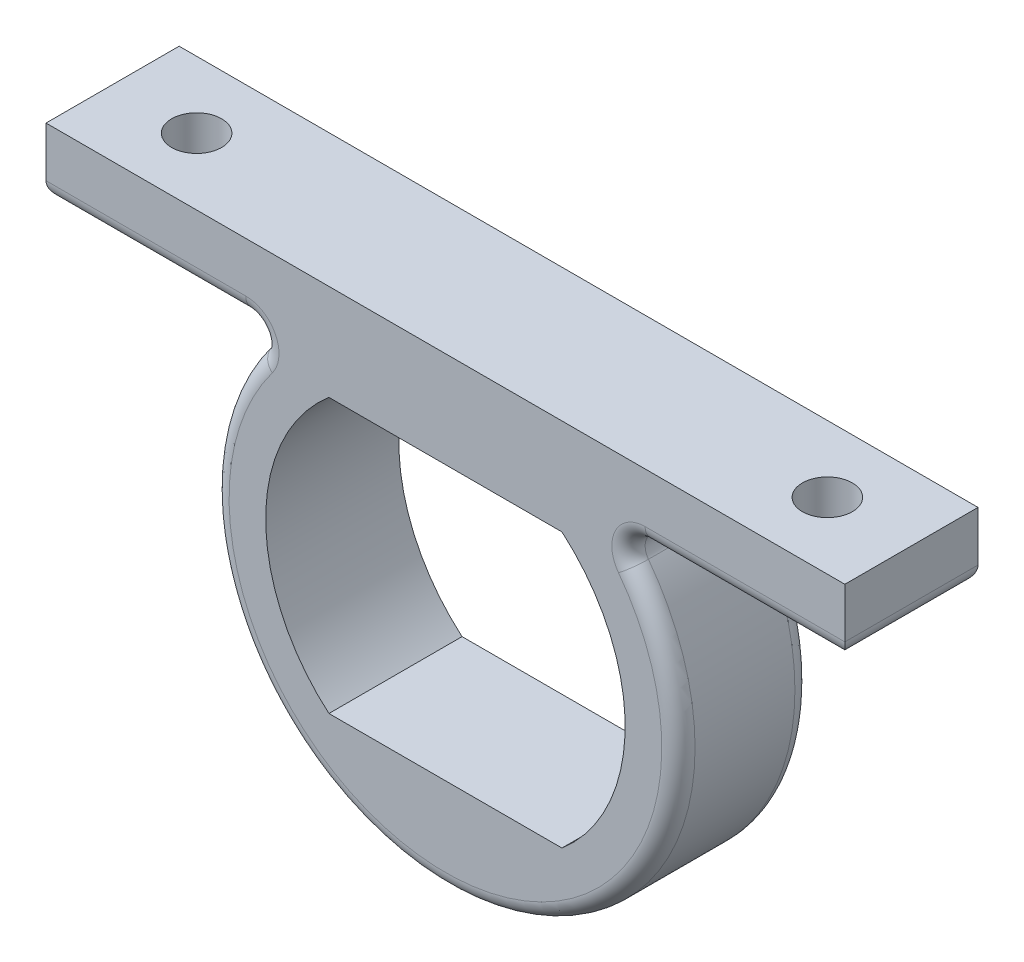
from build123d import *

# Parameters (mm, degrees)
SALIENTE_EXTRUIR1_DEPTH = 8
CORTAR_EXTRUIR1_DEPTH   = 29.91366459
REDONDEO1_R             = 1
CROQUIS3_R              = 1.5
CORTAR_EXTRUIR2_DEPTH   = 35.871191548


with BuildPart() as part:
    # Croquis1 → Saliente-Extruir1 (new body)
    with BuildSketch(Plane.XY):
        with BuildLine():
            Line((0, 14), (-24, 14))
            Line((-24, 14), (-24, 10))
            Line((-24, 10), (-9.797958971, 10))
            ThreePointArc((-9.797958971, 10), (0, -14), (9.797958971, 10))
            Line((9.797958971, 10), (24, 10))
            Line((24, 10), (24, 14))
            Line((24, 14), (0, 14))
        make_face()
    extrude(amount=SALIENTE_EXTRUIR1_DEPTH)

    # Croquis2 → Cortar-Extruir1 (cut, through all)
    with BuildSketch(Plane.XY.offset(8)):
        with BuildLine():
            Line((-7, 8.224354078), (7, 8.224354078))
            ThreePointArc((7, 8.224354078), (10.8, 0), (7, -8.224354078))
            Line((7, -8.224354078), (-7, -8.224354078))
            ThreePointArc((-7, -8.224354078), (-10.8, 0), (-7, 8.224354078))
        make_face()
    extrude(amount=-CORTAR_EXTRUIR1_DEPTH, mode=Mode.SUBTRACT)

    # Redondeo1
    redondeo1_edges = [part.edges().sort_by_distance(p)[0] for p in [
        (16.898979486, 10, 8),
        (-24, 10, 4),
        (-9.797958971, 10, 4),
        (9.797958971, 10, 4),
        (24, 10, 4),
        (0, -14, 8),
        (-16.898979486, 10, 8),
        (-16.898979486, 10, 0),
        (0, -14, 0),
        (16.898979486, 10, 0),
    ]]
    fillet(redondeo1_edges, radius=REDONDEO1_R)

    # Croquis3 → Cortar-Extruir2 (cut, through all)
    with BuildSketch(Plane(origin=(0, 10, 0), x_dir=(-1, 0, 0), z_dir=(0, -1, 0))):
        with Locations(Location((18.949489743, -4, 0), (0, 0, 90))):
            Circle(CROQUIS3_R)
        with Locations(Location((-18.949489743, -4, 0), (0, 0, 90))):
            Circle(CROQUIS3_R)
    extrude(amount=-CORTAR_EXTRUIR2_DEPTH, mode=Mode.SUBTRACT)


solid = part.part
